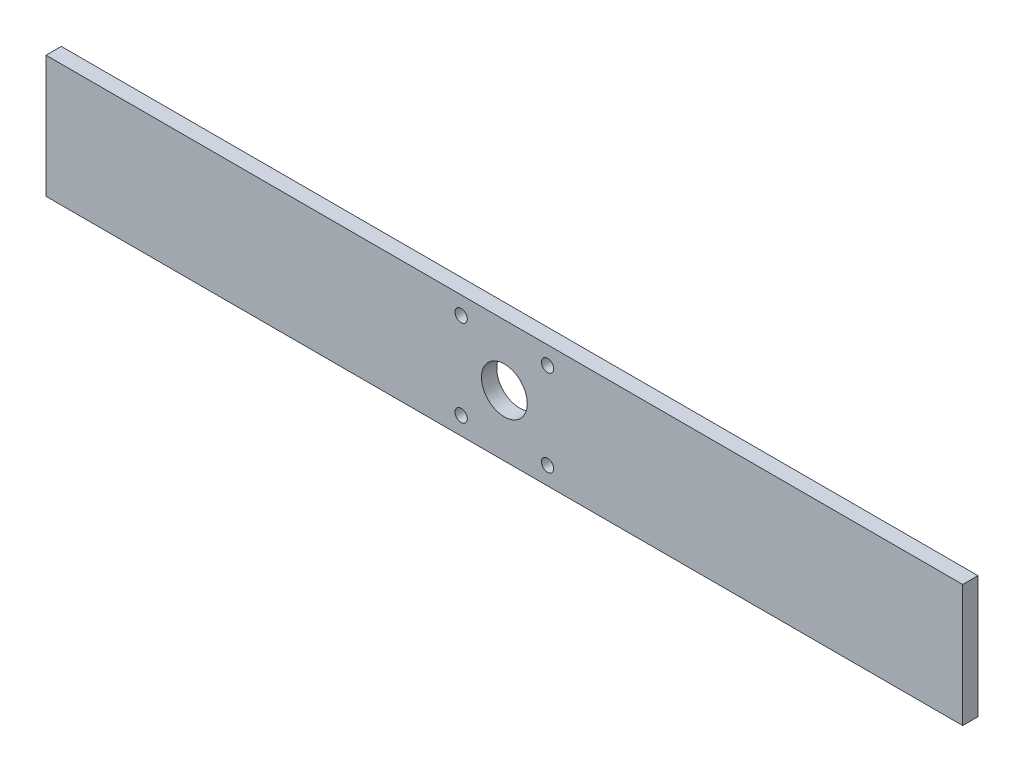
from build123d import *

# Parameters (mm, degrees)
SKETCH1_W                  = 381
SKETCH1_H                  = 50.8
BOSS_EXTRUDE1_DEPTH        = 6.35
SKETCH2_R                  = 9.525
CUT_EXTRUDE1_DEPTH         = 193.290749908
F_7_0_201_DIAMETER_HOLE1_D = 5.1054
CIRPATTERN1_COUNT          = 4


with BuildPart() as part:
    # Sketch1 → Boss-Extrude1 (new body)
    with BuildSketch(Plane.XY):
        Rectangle(SKETCH1_W, SKETCH1_H)
    extrude(amount=BOSS_EXTRUDE1_DEPTH)

    # Sketch2 → Cut-Extrude1 (cut, through all)
    with BuildSketch(Plane.XY.offset(6.35)):
        Circle(SKETCH2_R)
    extrude(amount=-CUT_EXTRUDE1_DEPTH, mode=Mode.SUBTRACT)

    # #7 (0.201) Diameter Hole1 (through all)
    with Locations(Plane.XY.offset(6.35)):
        with Locations((17.960512242, 17.960512242)):
            f_7_0_201_diameter_hole1 = Hole(F_7_0_201_DIAMETER_HOLE1_D / 2)

    # CirPattern1: #7 (0.201) Diameter Hole1 ×4 about axis
    cirpattern1_axis = Axis((0, 0, 0), (0, 0, 1))
    for i in range(1, CIRPATTERN1_COUNT):
        add(f_7_0_201_diameter_hole1.rotate(cirpattern1_axis, i * 360 / CIRPATTERN1_COUNT), mode=Mode.SUBTRACT)


solid = part.part
